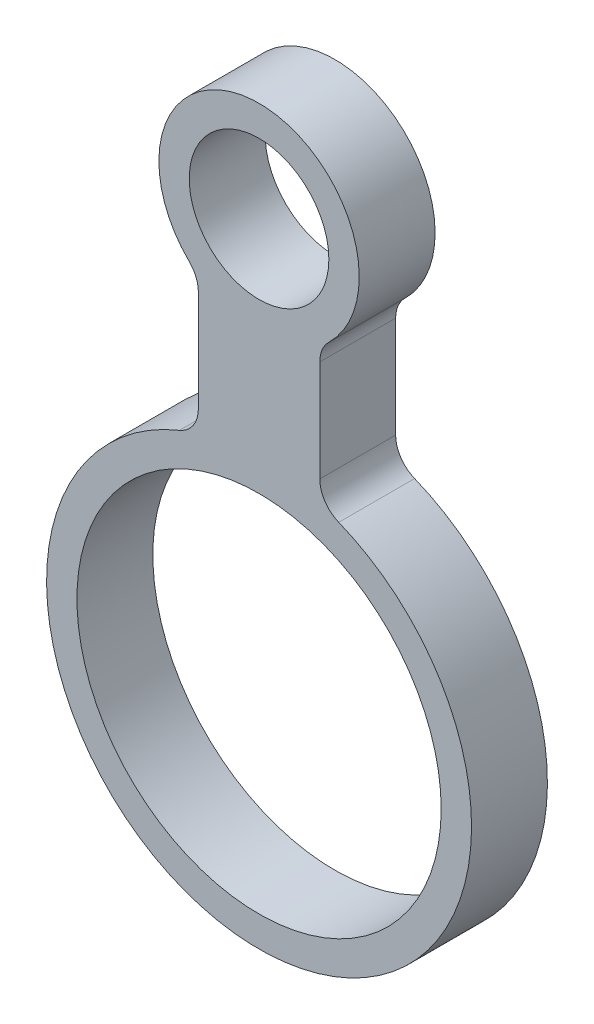
from build123d import *

# Parameters (mm, degrees)
SKETCH1_R           = 12
SKETCH1_R_2         = 4.6
BOSS_EXTRUDE1_DEPTH = 5
FILLET1_R           = 2


with BuildPart() as part:
    # Sketch1 → Boss-Extrude1 (new body)
    with BuildSketch(Plane.XY):
        with BuildLine():
            Line((-4, 22.416407865), (-4, 13.416407865))
            ThreePointArc((-4, 13.416407865), (0, -14), (4, 13.416407865))
            Line((4, 13.416407865), (4, 22.416407865))
            ThreePointArc((4, 22.416407865), (0, 34.266169764), (-4, 22.416407865))
        make_face()
        Circle(SKETCH1_R, mode=Mode.SUBTRACT)
        with Locations((0, 27.666169764)):
            Circle(SKETCH1_R_2, mode=Mode.SUBTRACT)
    extrude(amount=BOSS_EXTRUDE1_DEPTH)

    # Fillet1
    fillet1_edges = [part.edges().sort_by_distance(p)[0] for p in [
        (4, 22.416407865, 2.5),
        (4, 13.416407865, 2.5),
        (-4, 13.416407865, 2.5),
        (-4, 22.416407865, 2.5),
    ]]
    fillet(fillet1_edges, radius=FILLET1_R)


solid = part.part
